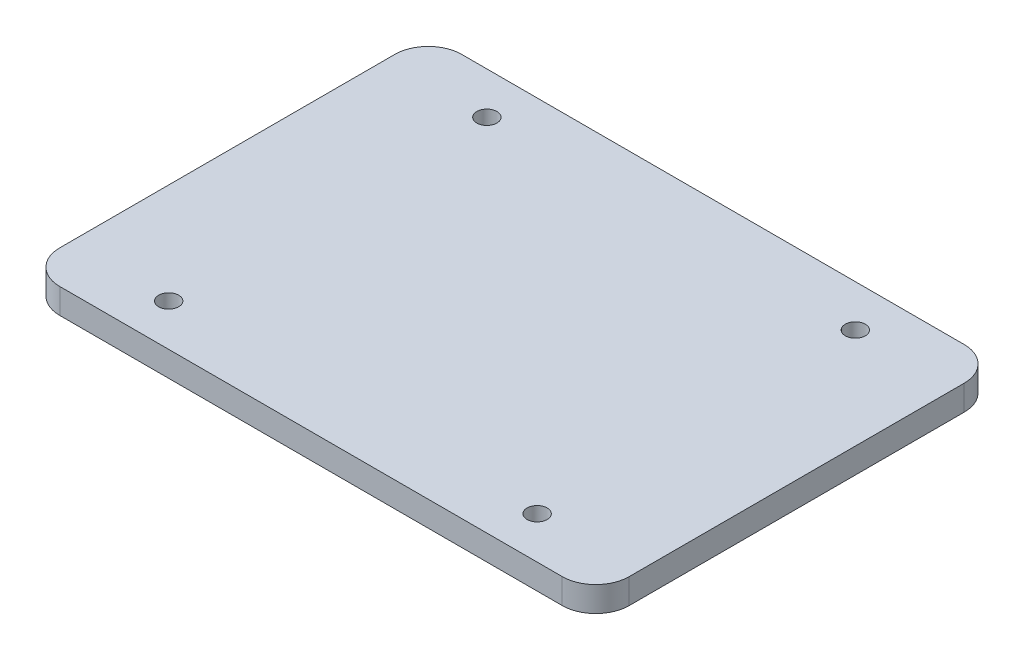
from build123d import *

# Parameters (mm, degrees)
EXTRUDE_1_DEPTH      = 15
SKETCH_2_10_R        = 6
CUT_EXTRUDE_10_DEPTH = 15
SKETCH_2_11_R        = 6
CUT_EXTRUDE_11_DEPTH = 15
SKETCH_2_12_R        = 6
CUT_EXTRUDE_12_DEPTH = 15
SKETCH_2_13_R        = 6
CUT_EXTRUDE_13_DEPTH = 15


with BuildPart() as part:
    # 草图2 → 凸台-拉伸1 (new body)
    with BuildSketch(Plane(origin=(0, 0, 0), x_dir=(1, 0, 0), z_dir=(0, 1, 0))):
        with BuildLine():
            Line((-150, 120), (150, 120))
            ThreePointArc((150, 120), (164.142135624, 114.142135624), (170, 100))
            Line((170, 100), (170, -100))
            ThreePointArc((170, -100), (164.142135624, -114.142135624), (150, -120))
            Line((150, -120), (-150, -120))
            ThreePointArc((-150, -120), (-164.142135624, -114.142135624), (-170, -100))
            Line((-170, -100), (-170, 100))
            ThreePointArc((-170, 100), (-164.142135624, 114.142135624), (-150, 120))
        make_face()
    extrude(amount=EXTRUDE_1_DEPTH)

    # 草图2<10> → 切除-拉伸10 (cut)
    with BuildSketch(Plane(origin=(0, 0, 0), x_dir=(1, 0, 0), z_dir=(0, 1, 0))):
        with Locations((-110, -95)):
            Circle(SKETCH_2_10_R)
    extrude(amount=CUT_EXTRUDE_10_DEPTH, mode=Mode.SUBTRACT)

    # 草图2<11> → 切除-拉伸11 (cut)
    with BuildSketch(Plane(origin=(0, 0, 0), x_dir=(1, 0, 0), z_dir=(0, 1, 0))):
        with Locations((110, -95)):
            Circle(SKETCH_2_11_R)
    extrude(amount=CUT_EXTRUDE_11_DEPTH, mode=Mode.SUBTRACT)

    # 草图2<12> → 切除-拉伸12 (cut)
    with BuildSketch(Plane(origin=(0, 0, 0), x_dir=(1, 0, 0), z_dir=(0, 1, 0))):
        with Locations((-110, 95)):
            Circle(SKETCH_2_12_R)
    extrude(amount=CUT_EXTRUDE_12_DEPTH, mode=Mode.SUBTRACT)

    # 草图2<13> → 切除-拉伸13 (cut)
    with BuildSketch(Plane(origin=(0, 0, 0), x_dir=(1, 0, 0), z_dir=(0, 1, 0))):
        with Locations((110, 95)):
            Circle(SKETCH_2_13_R)
    extrude(amount=CUT_EXTRUDE_13_DEPTH, mode=Mode.SUBTRACT)


solid = part.part
